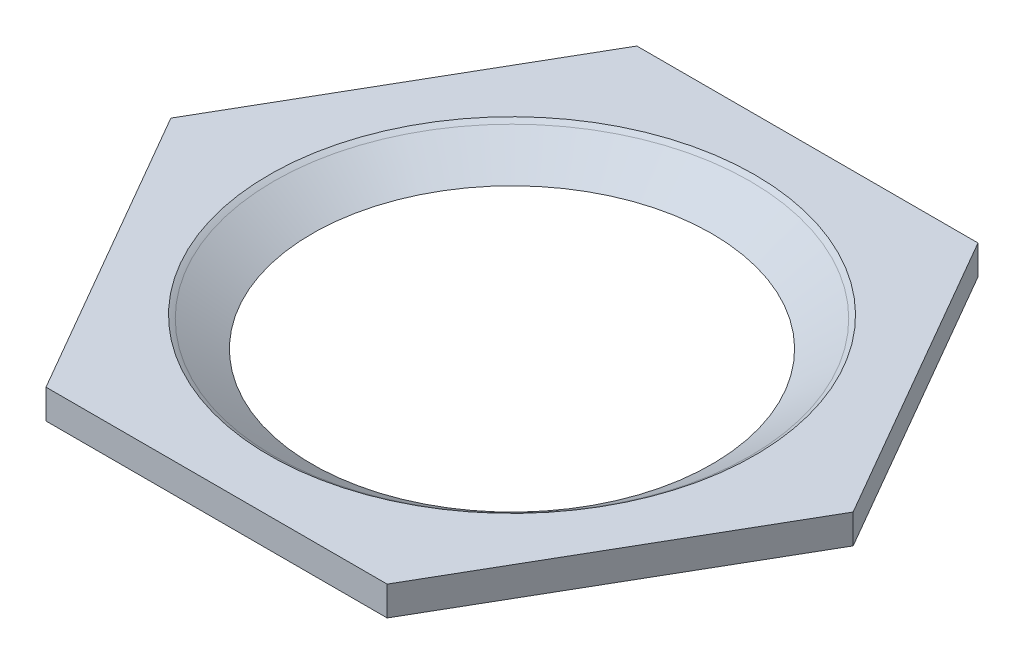
from build123d import *

# Parameters (mm, degrees)
EXT_HEX_DEPTH = 1.905


with BuildPart() as part:
    # Sk_hex → Ext_hex (new body)
    with BuildSketch(Plane(origin=(0, 64.4906, 0), x_dir=(1, 0, 0), z_dir=(0, 1, 0))):
        Polygon((22.143692224, 0), (11.071846112, -19.177), (-11.071846112, -19.177), (-22.143692224, 0), (-11.071846112, 19.177), (11.071846112, 19.177), align=None)
    extrude(amount=EXT_HEX_DEPTH)

    # Sk_hex_bore → Cut_hex_bore (revolve, cut)
    with BuildSketch(Plane.XY, mode=Mode.PRIVATE) as cut_hex_bore_sk:
        with BuildLine():
            Line((0, 64.008), (12.97178, 64.008))
            Line((12.97178, 64.008), (12.97178, 64.4906))
            Line((12.97178, 64.4906), (15.45717, 66.19494))
            ThreePointArc((15.45717, 66.19494), (15.611327894, 66.297467411), (15.76832, 66.3956))
            Line((15.76832, 66.3956), (15.76832, 66.802))
            Line((15.76832, 66.802), (0, 66.802))
            Line((0, 66.802), (0, 64.008))
        make_face()
    revolve(cut_hex_bore_sk.sketch.rotate(Axis((0, -25.4, 0), (0, 1, 0)), 90), axis=Axis((0, -25.4, 0), (0, 1, 0)), mode=Mode.SUBTRACT)


solid = part.part
